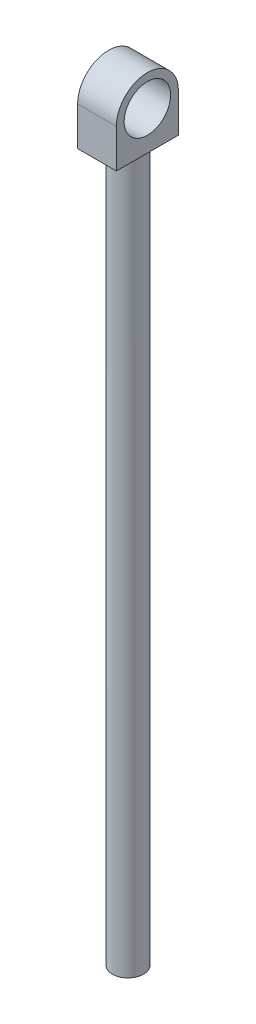
from build123d import *

# Parameters (mm, degrees)
SKETCH_1_R       = 2
EXTRUDE_1_DEPTH  = 60
SKETCH_8_R       = 3
EXTRUDE_8_DEPTH  = 2.5
EXTRUDE_START    = 15
SKETCH_9_R       = 2
EXTRUDE_9_DEPTH  = 15
EXTRUDE_START_2  = 5
SKETCH_12_R      = 2
EXTRUDE_11_DEPTH = 5
EXTRUDE_START_3  = 17
SKETCH_10_R      = 2
EXTRUDE_10_DEPTH = 12


with BuildPart() as part:
    # 草图1 → 凸台-拉伸1 (new body)
    with BuildSketch(Plane(origin=(0, 0, 0), x_dir=(1, 0, 0), z_dir=(0, 1, 0))):
        Circle(SKETCH_1_R)
    extrude(amount=EXTRUDE_1_DEPTH)

    # 草图8 → 凸台-拉伸8 (add, symmetric)
    with BuildSketch(Plane(origin=(0, 0, 0), x_dir=(0, 0, -1), z_dir=(1, 0, 0))):
        with BuildLine():
            Line((-4, 65), (-4, 60))
            Line((-4, 60), (4, 60))
            Line((4, 60), (4, 65))
            ThreePointArc((4, 65), (0, 69), (-4, 65))
        make_face()
        with Locations((0, 65)):
            Circle(SKETCH_8_R, mode=Mode.SUBTRACT)
    extrude(amount=EXTRUDE_8_DEPTH, both=True)

    # 草图9 → 凸台-拉伸9 (add)
    with BuildSketch(Plane.XZ.offset(EXTRUDE_START)):
        Circle(SKETCH_9_R)
    extrude(amount=-EXTRUDE_9_DEPTH)

    # 草图12 → 凸台-拉伸11 (add)
    with BuildSketch(Plane.XZ.offset(15).offset(EXTRUDE_START_2)):
        Circle(SKETCH_12_R)
    extrude(amount=-EXTRUDE_11_DEPTH)

    # 草图10 → 凸台-拉伸10 (add)
    with BuildSketch(Plane.XZ.offset(15).offset(EXTRUDE_START_3)):
        Circle(SKETCH_10_R)
    extrude(amount=-EXTRUDE_10_DEPTH)


solid = part.part
